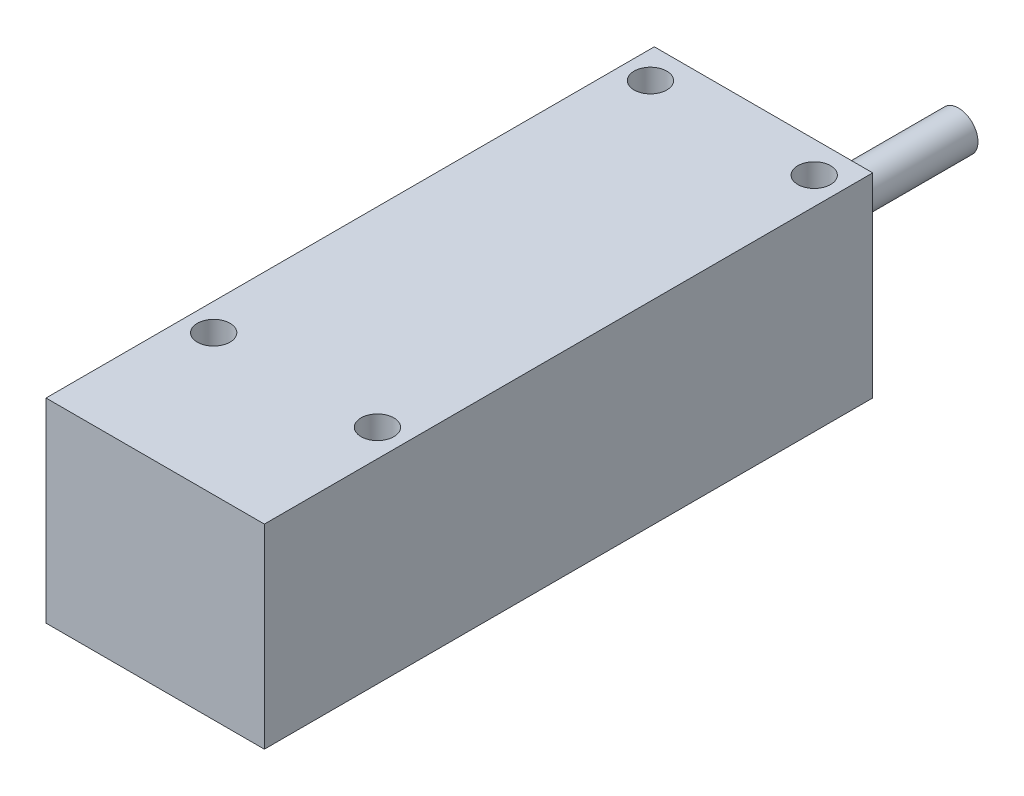
from build123d import *

# Parameters (mm, degrees)
SKETCH1_W           = 28
SKETCH1_H           = 25
BOSS_EXTRUDE1_DEPTH = 39
SKETCH2_R           = 2.1
CUT_EXTRUDE1_DEPTH  = 49.39421453
SKETCH3_R           = 2.5
BOSS_EXTRUDE2_DEPTH = 25


with BuildPart() as part:
    # Sketch1 → Boss-Extrude1 (new, symmetric)
    with BuildSketch(Plane.XY):
        Rectangle(SKETCH1_W, SKETCH1_H)
    extrude(amount=BOSS_EXTRUDE1_DEPTH, both=True)

    # Sketch2 → Cut-Extrude1 (cut, through all)
    with BuildSketch(Plane(origin=(0, 12.5, 0), x_dir=(1, 0, 0), z_dir=(0, 1, 0))):
        with Locations(Location((10.5, 35, 0), (0, 0, 180))):
            Circle(SKETCH2_R)
        with Locations(Location((10.5, -21, 0), (0, 0, 180))):
            Circle(SKETCH2_R)
    cut_extrude1 = extrude(amount=-CUT_EXTRUDE1_DEPTH, mode=Mode.SUBTRACT)

    # Mirror1: Cut-Extrude1 across plane
    add(cut_extrude1.mirror(Plane(origin=(0, 0, 0), x_dir=(0, 0, 1), z_dir=(1, 0, 0))), mode=Mode.SUBTRACT)

    # Sketch3 → Boss-Extrude2 (add)
    with BuildSketch(Plane(origin=(0, 0, -39), x_dir=(-1, 0, 0), z_dir=(0, 0, -1))):
        with Locations(Location((0, -2.3, 0), (0, 0, 180))):
            Circle(SKETCH3_R)
    extrude(amount=BOSS_EXTRUDE2_DEPTH)


solid = part.part
